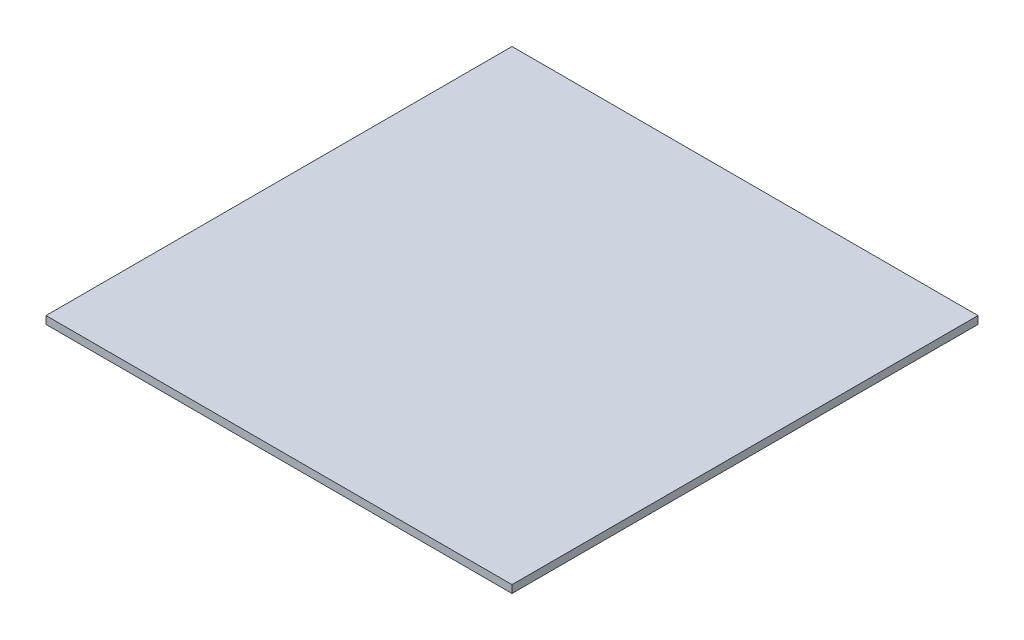
from build123d import *

# Parameters (mm, degrees)
SKETCH1_W           = 307.0225
SKETCH1_H           = 307.0225
BOSS_EXTRUDE1_DEPTH = 5.08


with BuildPart() as part:
    # Sketch1 → Boss-Extrude1 (new body)
    with BuildSketch(Plane(origin=(0, 0, 0), x_dir=(1, 0, 0), z_dir=(0, 1, 0))):
        with Locations((153.51125, 153.51125)):
            Rectangle(SKETCH1_W, SKETCH1_H)
    extrude(amount=BOSS_EXTRUDE1_DEPTH)


solid = part.part
